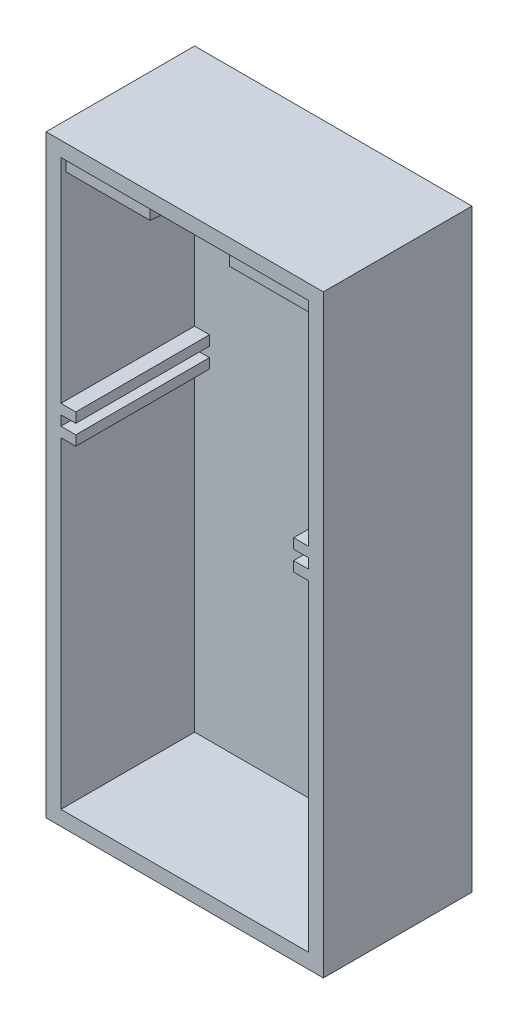
from build123d import *

# Parameters (mm, degrees)
SKETCH1_W           = 56
SKETCH1_H           = 120
BOSS_EXTRUDE1_DEPTH = 30
SHELL1_T            = -3
SKETCH2_W           = 50
SKETCH2_H           = 3
BOSS_EXTRUDE2_DEPTH = 26
CUT_EXTRUDE5_DEPTH  = 3
SKETCH6_W           = 30
SKETCH6_H           = 2
BOSS_EXTRUDE3_DEPTH = 3
SKETCH7_W           = 30
SKETCH7_H           = 2
BOSS_EXTRUDE4_DEPTH = 3


with BuildPart() as part:
    # Sketch1 → Boss-Extrude1 (new body)
    with BuildSketch(Plane.XY):
        with Locations((-28, 60)):
            Rectangle(SKETCH1_W, SKETCH1_H)
    extrude(amount=BOSS_EXTRUDE1_DEPTH)

    # Shell1
    shell1_openings = [part.faces().sort_by_distance(p)[0] for p in [
        (-28, 60, 30),
    ]]
    offset(amount=SHELL1_T, openings=shell1_openings, kind=Kind.INTERSECTION)

    # Sketch2 → Boss-Extrude2 (add)
    with BuildSketch(Plane.XY.offset(3)):
        with Locations((-28, 115.5)):
            Rectangle(SKETCH2_W, SKETCH2_H)
    extrude(amount=BOSS_EXTRUDE2_DEPTH)

    # Sketch3 → Cut-Extrude5 (cut)
    with BuildSketch(Plane.XZ.offset(-114)):
        with BuildLine():
            Line((-36, 29), (-20, 29))
            ThreePointArc((-20, 29), (-28, 21), (-36, 29))
        make_face()
    extrude(amount=-CUT_EXTRUDE5_DEPTH, mode=Mode.SUBTRACT)

    # Sketch6 → Boss-Extrude3 (add)
    with BuildSketch(Plane(origin=(-53, 0, 0), x_dir=(0, 0, -1), z_dir=(1, 0, 0))):
        with Locations((-15, 73)):
            Rectangle(SKETCH6_W, SKETCH6_H)
    boss_extrude3 = extrude(amount=BOSS_EXTRUDE3_DEPTH)

    # Sketch7 → Boss-Extrude4 (add)
    with BuildSketch(Plane(origin=(-53, 0, 0), x_dir=(0, 0, -1), z_dir=(1, 0, 0))):
        with Locations((-15, 69)):
            Rectangle(SKETCH7_W, SKETCH7_H)
    boss_extrude4 = extrude(amount=BOSS_EXTRUDE4_DEPTH)

    # Mirror1: Boss-Extrude3, Boss-Extrude4 across plane
    add(boss_extrude3.mirror(Plane(origin=(-28, 0, 0), x_dir=(0, 0, 1), z_dir=(1, 0, 0))))
    add(boss_extrude4.mirror(Plane(origin=(-28, 0, 0), x_dir=(0, 0, 1), z_dir=(1, 0, 0))))


solid = part.part
